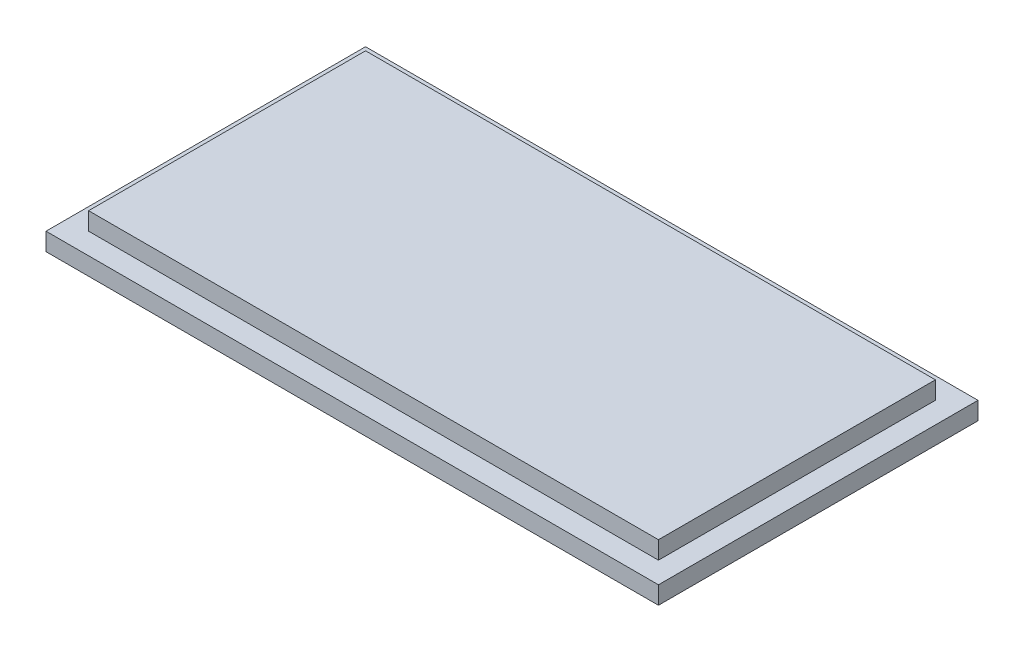
from build123d import *

# Parameters (mm, degrees)
SKETCH1_W           = 34.5
SKETCH1_H           = 18
BOSS_EXTRUDE1_DEPTH = 1
SKETCH2_W           = 32.1
SKETCH2_H           = 15.6
BOSS_EXTRUDE2_DEPTH = 1


with BuildPart() as part:
    # Sketch1 → Boss-Extrude1 (new body)
    with BuildSketch(Plane(origin=(0, 0, 0), x_dir=(1, 0, 0), z_dir=(0, 1, 0))):
        Rectangle(SKETCH1_W, SKETCH1_H)
    extrude(amount=BOSS_EXTRUDE1_DEPTH)

    # Sketch2 → Boss-Extrude2 (add)
    with BuildSketch(Plane(origin=(0, 1, 0), x_dir=(1, 0, 0), z_dir=(0, 1, 0))):
        Rectangle(SKETCH2_W, SKETCH2_H)
    extrude(amount=BOSS_EXTRUDE2_DEPTH)


solid = part.part
